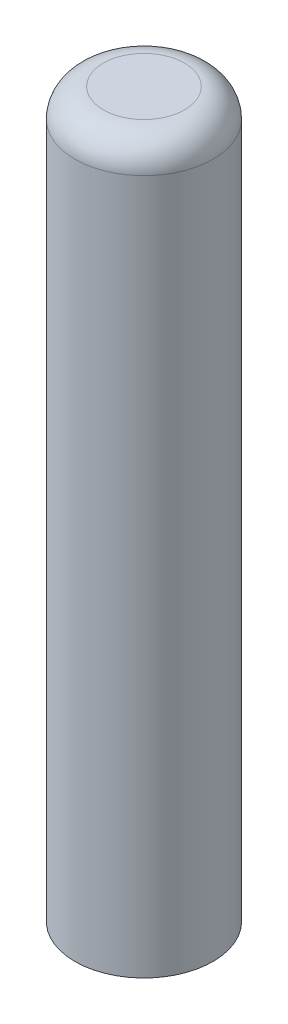
from build123d import *

# Parameters (mm, degrees)
SKETCH1_R           = 3.15
BOSS_EXTRUDE1_DEPTH = 33
FILLET1_R           = 1.3
SKETCH2_R           = 1.5
CUT_EXTRUDE1_DEPTH  = 12


with BuildPart() as part:
    # Sketch1 → Boss-Extrude1 (new body)
    with BuildSketch(Plane(origin=(0, 0, 0), x_dir=(1, 0, 0), z_dir=(0, 1, 0))):
        with Locations(Location((0, 0, 0), (0, 0, 270))):
            Circle(SKETCH1_R)
    extrude(amount=BOSS_EXTRUDE1_DEPTH)

    # Fillet1
    fillet1_edges = [part.edges().sort_by_distance(p)[0] for p in [
        (0, 33, -3.15),
    ]]
    fillet(fillet1_edges, radius=FILLET1_R)

    # Sketch2 → Cut-Extrude1 (cut)
    with BuildSketch(Plane.XZ):
        with Locations(Location((0, 0, 0), (0, 0, 270))):
            Circle(SKETCH2_R)
    extrude(amount=-CUT_EXTRUDE1_DEPTH, mode=Mode.SUBTRACT)


solid = part.part
